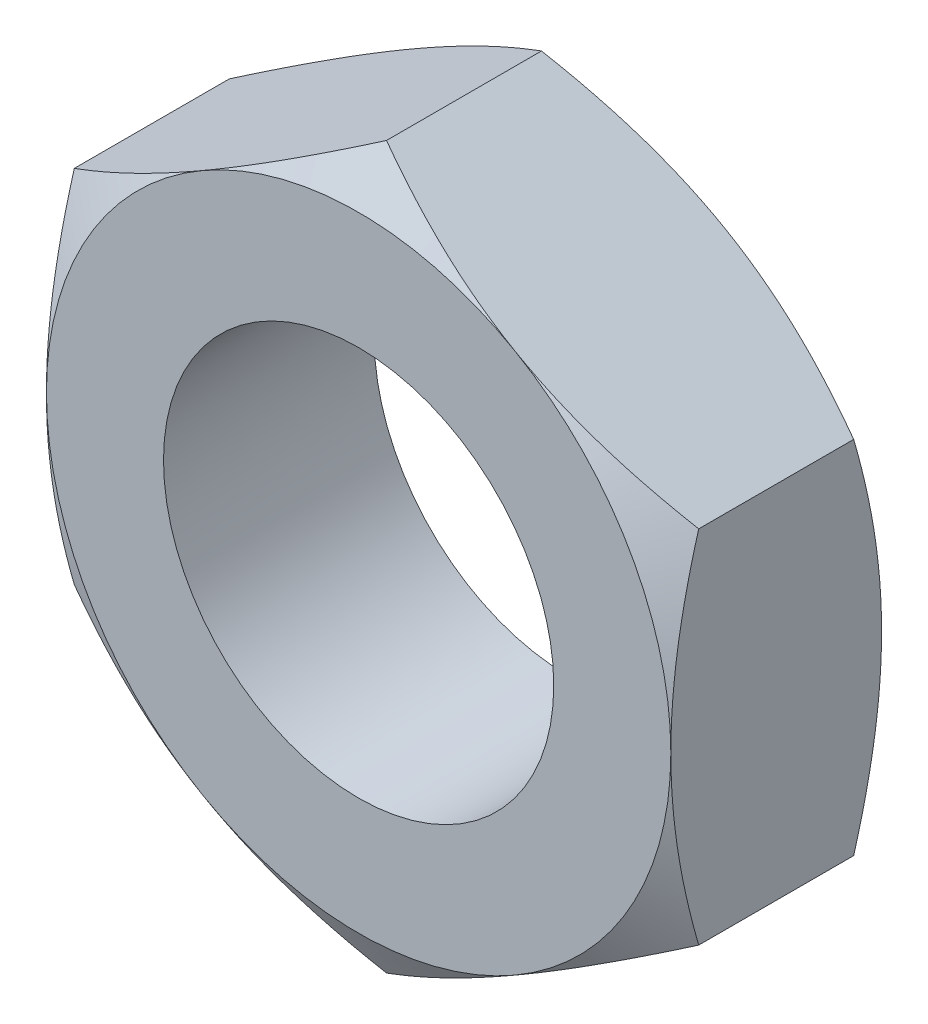
from build123d import *

# Parameters (mm, degrees)
SZKIC1_R                    = 2.5
DODANIE_WYCI_GNI_CIE1_DEPTH = 1.35
SZKIC2_OUTSIDE_W            = 21.856
SZKIC2_OUTSIDE_H            = 23.094
SZKIC2_OUTSIDE_R            = 4
WYTNIJ_WYCI_GNI_CIE2_DEPTH  = 2.7
WYTNIJ_WYCI_GNI_CIE2_DRAFT  = -60
LUSTRO1_COPY_1_SKETCH_W     = 21.856
LUSTRO1_COPY_1_SKETCH_H     = 23.094
LUSTRO1_COPY_1_SKETCH_R     = 4
LUSTRO1_COPY_1_DEPTH        = 2.7
LUSTRO1_COPY_1_DRAFT        = -60


with BuildPart() as part:
    # Szkic1 → Dodanie-wyciągnięcie1 (new, symmetric)
    with BuildSketch(Plane.XY):
        Polygon((-4, 2.309401077), (-4, -2.309401077), (0, -4.618802154), (4, -2.309401077), (4, 2.309401077), (0, 4.618802154), align=None)
        with Locations(Location((0, 0, 0), (0, 0, 180))):
            Circle(SZKIC1_R, mode=Mode.SUBTRACT)
    extrude(amount=DODANIE_WYCI_GNI_CIE1_DEPTH, both=True)


with BuildPart() as wytnij_wyci_gni_cie2_tool:
    # Szkic2 outside → Wytnij-wyciągnięcie2 (with draft: the straight prism first)
    with BuildSketch(Plane.XY.offset(1.35)):
        Rectangle(SZKIC2_OUTSIDE_W, SZKIC2_OUTSIDE_H)
        Circle(SZKIC2_OUTSIDE_R, mode=Mode.SUBTRACT)
    extrude(amount=-WYTNIJ_WYCI_GNI_CIE2_DEPTH)
    # Wytnij-wyciągnięcie2: the draft: its side faces are tilted about the plane it starts from
    wytnij_wyci_gni_cie2_sides = [wytnij_wyci_gni_cie2_tool.faces().sort_by_distance(p)[0] for p in [
        (0, -11.547, 0),
        (10.928, 0, 0),
        (0, 11.547, 0),
        (-10.928, 0, 0),
        (-4, 0, 0),
    ]]
    draft(wytnij_wyci_gni_cie2_sides, Plane.XY.offset(1.35), WYTNIJ_WYCI_GNI_CIE2_DRAFT)


with BuildPart() as part_1:
    add(part.part)

    # Wytnij-wyciągnięcie2: cut by wytnij_wyci_gni_cie2_tool
    add(wytnij_wyci_gni_cie2_tool.part, mode=Mode.SUBTRACT)


with BuildPart() as lustro1_copy_1_tool:
    # Lustro1 copy 1 sketch → Lustro1 copy 1 (with draft: the straight prism first)
    with BuildSketch(Plane(origin=(0, 0, -1.35), x_dir=(1, 0, 0), z_dir=(0, 0, -1))):
        Rectangle(LUSTRO1_COPY_1_SKETCH_W, LUSTRO1_COPY_1_SKETCH_H)
        Circle(LUSTRO1_COPY_1_SKETCH_R, mode=Mode.SUBTRACT)
    extrude(amount=-LUSTRO1_COPY_1_DEPTH)
    # Lustro1 copy 1: the draft: its side faces are tilted about the plane it starts from
    lustro1_copy_1_sides = [lustro1_copy_1_tool.faces().sort_by_distance(p)[0] for p in [
        (0, -11.547, 0),
        (10.928, 0, 0),
        (0, 11.547, 0),
        (-10.928, 0, 0),
        (-4, 0, 0),
    ]]
    draft(lustro1_copy_1_sides, Plane(origin=(0, 0, -1.35), x_dir=(1, 0, 0), z_dir=(0, 0, -1)), LUSTRO1_COPY_1_DRAFT)


with BuildPart() as part_2:
    add(part_1.part)

    # Lustro1 copy 1: cut by lustro1_copy_1_tool
    add(lustro1_copy_1_tool.part, mode=Mode.SUBTRACT)


solid = part_2.part
